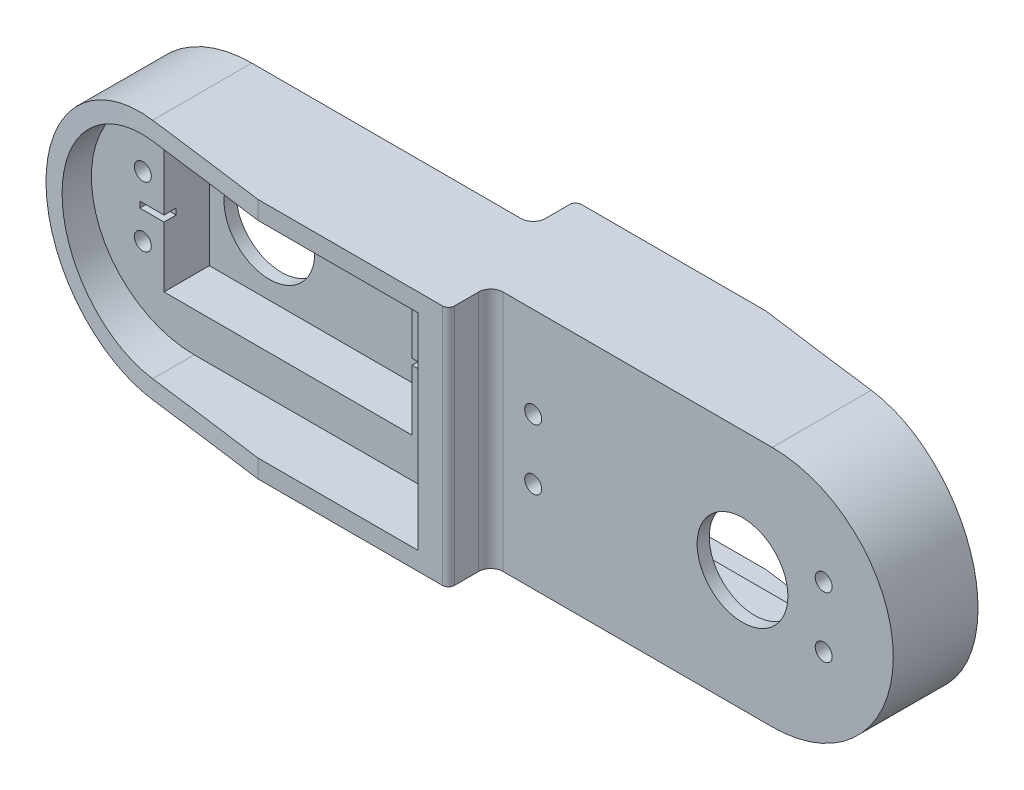
from build123d import *

# Parameters (mm, degrees)
SKETCH1_W               = 138
SKETCH1_H               = 40
SKETCH1_W_2             = 41
SKETCH1_H_2             = 21
BOSS_EXTRUDE1_DEPTH     = 12
FILLET1_RADIUS          = 20
FILLET1_LENGTH          = 12
FILLET2_RADIUS          = 20
FILLET2_LENGTH          = 12
BOSS_EXTRUDE3_START     = 7
BOSS_EXTRUDE3_DEPTH     = 7
BOSS_EXTRUDE4_START     = 7
BOSS_EXTRUDE4_DEPTH     = 7
CUT_EXTRUDE1_DEPTH      = 75.310160813
CUT_EXTRUDE1_DEPTH_BACK = 75.310160813
CUT_EXTRUDE2_DEPTH      = 2.5
SKETCH9_W               = 41
SKETCH9_H               = 21
CUT_EXTRUDE3_DEPTH      = 2.5
SKETCH10_W              = 41
SKETCH10_H              = 21
SKETCH10_R              = 7.5
BOSS_EXTRUDE5_DEPTH     = 2
SKETCH11_W              = 41
SKETCH11_H              = 21
SKETCH11_R              = 7.5
BOSS_EXTRUDE6_DEPTH     = 2
SKETCH12_W              = 4
SKETCH12_H              = 1
CUT_EXTRUDE4_DEPTH      = 2
SKETCH13_W              = 3
SKETCH13_H              = 1
CUT_EXTRUDE5_DEPTH      = 2
FILLET4_R               = 2
FILLET5_R               = 2
FILLET6_R               = 1
SKETCH14_R              = 1.4
CUT_EXTRUDE6_DEPTH      = 74.71058283
SKETCH15_R              = 1.4
CUT_EXTRUDE7_DEPTH      = 74.71058283


with BuildPart() as part:
    # Sketch1 → Boss-Extrude1 (new body)
    with BuildSketch(Plane.XY):
        Rectangle(SKETCH1_W, SKETCH1_H)
        with Locations((-33.5, 0)):
            Rectangle(SKETCH1_W_2, SKETCH1_H_2, mode=Mode.SUBTRACT)
        with Locations((33.5, 0)):
            Rectangle(SKETCH1_W_2, SKETCH1_H_2, mode=Mode.SUBTRACT)
    extrude(amount=BOSS_EXTRUDE1_DEPTH)

    # Fillet1: full round fillet: the end face becomes a half cylinder, R = half its width
    fillet1_face = Plane((-69, 0, 6), x_dir=(0, 0, 1), z_dir=(-1, 0, 0))  # on the end face: x along it, z out of the body
    fillet1_slab = fillet1_face.offset(-FILLET1_RADIUS / 2) * Box(FILLET1_LENGTH, 2 * FILLET1_RADIUS, FILLET1_RADIUS, mode=Mode.PRIVATE)  # the body's end, R deep
    fillet1_round = Plane((-49, 0, 6), x_dir=(-1, 0, 0), z_dir=(0, 0, 1)) * Cylinder(FILLET1_RADIUS, FILLET1_LENGTH, mode=Mode.PRIVATE)  # its axis R under the face
    add(fillet1_slab - fillet1_round, mode=Mode.SUBTRACT)

    # Fillet2: full round fillet: the end face becomes a half cylinder, R = half its width
    fillet2_face = Plane((69, 0, 6), x_dir=(0, 0, -1), z_dir=(1, 0, 0))  # on the end face: x along it, z out of the body
    fillet2_slab = fillet2_face.offset(-FILLET2_RADIUS / 2) * Box(FILLET2_LENGTH, 2 * FILLET2_RADIUS, FILLET2_RADIUS, mode=Mode.PRIVATE)  # the body's end, R deep
    fillet2_round = Plane((49, 0, 6), x_dir=(1, 0, 0), z_dir=(0, 0, -1)) * Cylinder(FILLET2_RADIUS, FILLET2_LENGTH, mode=Mode.PRIVATE)  # its axis R under the face
    add(fillet2_slab - fillet2_round, mode=Mode.SUBTRACT)

    # Sketch3 → Boss-Extrude3 (add)
    with BuildSketch(Plane.XY.offset(12).offset(BOSS_EXTRUDE3_START)):
        with BuildLine():
            Line((-49, -20), (-2.5, -20))
            Line((-2.5, -20), (2.5, -20))
            Line((2.5, -20), (2.5, 20))
            Line((2.5, 20), (-2.5, 20))
            Line((-2.5, 20), (-49, 20))
            ThreePointArc((-49, 20), (-69, 0), (-49, -20))
        make_face()
        with BuildLine():
            Line((-2.5, 17), (-2.5, -17))
            Line((-2.5, -17), (-49, -17))
            ThreePointArc((-49, -17), (-66, 0), (-49, 17))
            Line((-49, 17), (-2.5, 17))
        make_face(mode=Mode.SUBTRACT)
    extrude(amount=-BOSS_EXTRUDE3_DEPTH)

    # Sketch5 → Boss-Extrude4 (add)
    with BuildSketch(Plane(origin=(0, 0, 0), x_dir=(-1, 0, 0), z_dir=(0, 0, -1)).offset(BOSS_EXTRUDE4_START)):
        with BuildLine():
            Line((-49, -20), (-2.5, -20))
            Line((-2.5, -20), (2.5, -20))
            Line((2.5, -20), (2.5, 20))
            Line((2.5, 20), (-2.5, 20))
            Line((-2.5, 20), (-49, 20))
            ThreePointArc((-49, 20), (-69, 0), (-49, -20))
        make_face()
        with BuildLine():
            Line((-2.5, 17), (-2.5, -17))
            Line((-2.5, -17), (-49, -17))
            ThreePointArc((-49, -17), (-66, 0), (-49, 17))
            Line((-49, 17), (-2.5, 17))
        make_face(mode=Mode.SUBTRACT)
    extrude(amount=-BOSS_EXTRUDE4_DEPTH)

    # Sketch6 → Cut-Extrude1 (cut, two sides: drawn at the far end of the back side and taken through both)
    with BuildSketch(Plane(origin=(0, 0, 0), x_dir=(1, 0, 0), z_dir=(0, 1, 0)).offset(-CUT_EXTRUDE1_DEPTH_BACK)):
        with BuildLine():
            Line((-69, -19), (-29, -19))
            add(Edge.make_bspline(
                [(-69, -14), (-48.966763925, -16.237598457), (-29, -19)],
                knots=[0, 0, 0, 1, 1, 1], degree=2))
            Line((-69, -14), (-69, -19))
        make_face()
        with BuildLine():
            Line((69, 7), (29, 7))
            add(Edge.make_bspline(
                [(69, 2), (48.966763925, 4.237598457), (29, 7)],
                knots=[0, 0, 0, 1, 1, 1], degree=2))
            Line((69, 2), (69, 7))
        make_face()
    extrude(amount=CUT_EXTRUDE1_DEPTH + CUT_EXTRUDE1_DEPTH_BACK, mode=Mode.SUBTRACT)

    # Sketch8 → Cut-Extrude2 (cut)
    with BuildSketch(Plane.XY.offset(12)):
        with BuildLine():
            Line((-49, -17), (-2.5, -17))
            Line((-2.5, -17), (-2.5, 17))
            Line((-2.5, 17), (-29, 17))
            Line((-29, 17), (-49, 17))
            ThreePointArc((-49, 17), (-66, 0), (-49, -17))
        make_face()
    extrude(amount=-CUT_EXTRUDE2_DEPTH, mode=Mode.SUBTRACT)

    # Sketch9 → Cut-Extrude3 (cut)
    with BuildSketch(Plane(origin=(0, 0, 0), x_dir=(-1, 0, 0), z_dir=(0, 0, -1))):
        with BuildLine():
            ThreePointArc((-49, 17), (-66, 0), (-49, -17))
            Line((-49, -17), (-2.5, -17))
            Line((-2.5, -17), (-2.5, 17))
            Line((-2.5, 17), (-29, 17))
            Line((-29, 17), (-49, 17))
        make_face()
        with Locations((-33.5, 0)):
            Rectangle(SKETCH9_W, SKETCH9_H, mode=Mode.SUBTRACT)
    extrude(amount=-CUT_EXTRUDE3_DEPTH, mode=Mode.SUBTRACT)

    # Sketch10 → Boss-Extrude5 (add)
    with BuildSketch(Plane.XY.offset(12)):
        with Locations((33.5, 0)):
            Rectangle(SKETCH10_W, SKETCH10_H)
        with Locations((44.09, 0)):
            Circle(SKETCH10_R, mode=Mode.SUBTRACT)
    extrude(amount=-BOSS_EXTRUDE5_DEPTH)

    # Sketch11 → Boss-Extrude6 (add)
    with BuildSketch(Plane(origin=(0, 0, 0), x_dir=(-1, 0, 0), z_dir=(0, 0, -1))):
        with Locations((33.5, 0)):
            Rectangle(SKETCH11_W, SKETCH11_H)
        with Locations((44.09, 0)):
            Circle(SKETCH11_R, mode=Mode.SUBTRACT)
    extrude(amount=-BOSS_EXTRUDE6_DEPTH)

    # Sketch12 → Cut-Extrude4 (cut)
    with BuildSketch(Plane.XY.offset(9.5)):
        with Locations((-56, 0)):
            Rectangle(SKETCH12_W, SKETCH12_H)
        with Locations((-11, 0)):
            Rectangle(SKETCH12_W, SKETCH12_H)
    extrude(amount=-CUT_EXTRUDE4_DEPTH, mode=Mode.SUBTRACT)

    # Sketch13 → Cut-Extrude5 (cut)
    with BuildSketch(Plane(origin=(0, 0, 2.5), x_dir=(-1, 0, 0), z_dir=(0, 0, -1))):
        with Locations((-55.5, 0)):
            Rectangle(SKETCH13_W, SKETCH13_H)
        with Locations((-11.5, 0)):
            Rectangle(SKETCH13_W, SKETCH13_H)
    extrude(amount=-CUT_EXTRUDE5_DEPTH, mode=Mode.SUBTRACT)

    # Fillet4
    fillet4_edges = [part.edges().sort_by_distance(p)[0] for p in [
        (2.5, 0, 12),
    ]]
    fillet(fillet4_edges, radius=FILLET4_R)

    # Fillet5
    fillet5_edges = [part.edges().sort_by_distance(p)[0] for p in [
        (-2.5, 0, 0),
    ]]
    fillet(fillet5_edges, radius=FILLET5_R)

    # Fillet6
    fillet6_edges = [part.edges().sort_by_distance(p)[0] for p in [
        (2.5, 0, 19),
        (-2.5, 0, -7),
    ]]
    fillet(fillet6_edges, radius=FILLET6_R)

    # Sketch14 → Cut-Extrude6 (cut, through all)
    with BuildSketch(Plane(origin=(0, 0, 2.5), x_dir=(-1, 0, 0), z_dir=(0, 0, -1))):
        with Locations((-57.5, 5)):
            Circle(SKETCH14_R)
        with Locations((-57.5, -5)):
            Circle(SKETCH14_R)
        with Locations((-9.5, 5)):
            Circle(SKETCH14_R)
        with Locations((-9.5, -5)):
            Circle(SKETCH14_R)
    extrude(amount=-CUT_EXTRUDE6_DEPTH, mode=Mode.SUBTRACT)

    # Sketch15 → Cut-Extrude7 (cut, through all)
    with BuildSketch(Plane.XY.offset(9.5)):
        with Locations((-57.5, 5)):
            Circle(SKETCH15_R)
        with Locations((-57.5, -5)):
            Circle(SKETCH15_R)
        with Locations((-9.5, -5)):
            Circle(SKETCH15_R)
        with Locations((-9.5, 5)):
            Circle(SKETCH15_R)
    extrude(amount=-CUT_EXTRUDE7_DEPTH, mode=Mode.SUBTRACT)


solid = part.part
